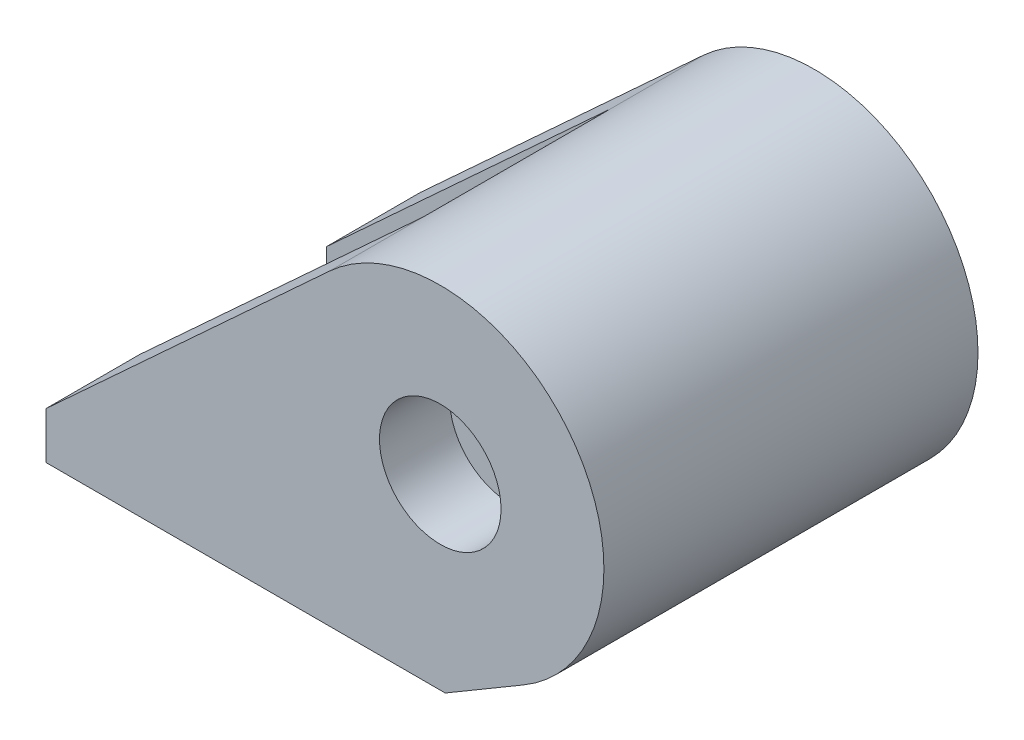
from build123d import *
from build123d.topology import SkipClean

# Parameters (mm, degrees)
EXTRUDE_1_DEPTH          = 80
SKETCH_2_R               = 13
CUT_EXTRUDE_2_DEPTH      = 15
CUT_EXTRUDE_START        = -15
SKETCH_4_R               = 13
CUT_EXTRUDE_3_DEPTH      = 15
CUT_EXTRUDE_4_DEPTH      = 123.918354375
CUT_EXTRUDE_4_DEPTH_BACK = 123.918354375
SKETCH_5_W               = 20
SKETCH_5_H               = 40
CUT_EXTRUDE_6_DEPTH      = 123.918354375
CUT_EXTRUDE_6_DEPTH_BACK = 24
CUT_EXTRUDE_7_DEPTH      = 131.345394404
CUT_EXTRUDE_8_DEPTH      = 32
CUT_EXTRUDE_8_DEPTH_BACK = 24
SKETCH_10_W              = 30
SKETCH_10_H              = 40
CUT_EXTRUDE_9_DEPTH      = 6
SKETCH_13_W              = 10.619852086
SKETCH_13_H              = 40
CUT_EXTRUDE_10_DEPTH     = 71
EXTRUDE_3_DEPTH          = 60


with BuildPart() as part:
    # Эскиз1 → Бобышка-Вытянуть1 (new body)
    with BuildSketch(Plane.XY):
        with BuildLine():
            Line((-84.314422505, -30), (-23.694570419, 25.759800711))
            ThreePointArc((-23.694570419, 25.759800711), (28.113366731, 20.847988178), (17.769230769, -30.153846154))
            Line((17.769230769, -30.153846154), (1.060606061, -40))
            Line((1.060606061, -40), (-84.314422505, -40))
            Line((-84.314422505, -40), (-84.314422505, -30))
        make_face()
    extrude(amount=EXTRUDE_1_DEPTH)

    # Эскиз2 → Вырез-Вытянуть2 (cut)
    with BuildSketch(Plane.XY):
        Circle(SKETCH_2_R)
    extrude(amount=CUT_EXTRUDE_2_DEPTH, mode=Mode.SUBTRACT)

    # Эскиз4 → Вырез-Вытянуть3 (cut)
    with BuildSketch(Plane.XY.offset(80).offset(CUT_EXTRUDE_START)):
        Circle(SKETCH_4_R)
    extrude(amount=CUT_EXTRUDE_3_DEPTH, mode=Mode.SUBTRACT)

    # Эскиз5 → Вырез-Вытянуть4 (cut, two sides: drawn at the far end of the back side and taken through both)
    with BuildSketch(Plane(origin=(0, 0, 0), x_dir=(1, 0, 0), z_dir=(0, 1, 0)).offset(-CUT_EXTRUDE_4_DEPTH_BACK)):
        with Locations((-74.314422505, -40)):
            Rectangle(SKETCH_5_W, SKETCH_5_H)
    extrude(amount=CUT_EXTRUDE_4_DEPTH + CUT_EXTRUDE_4_DEPTH_BACK, mode=Mode.SUBTRACT)

    # Эскиз6 → Вырез-Вытянуть6 (cut, two sides: drawn at the far end of the back side and taken through both)
    with BuildSketch(Plane(origin=(0, 0, 0), x_dir=(1, 0, 0), z_dir=(0, 1, 0)).offset(-CUT_EXTRUDE_6_DEPTH_BACK)):
        with BuildLine():
            Line((-55, -25), (-84.314422505, -25))
            Line((-84.314422505, -25), (-84.314422505, -55))
            Line((-84.314422505, -55), (-55, -55))
            ThreePointArc((-55, -55), (-40, -40), (-55, -25))
        make_face()
    extrude(amount=CUT_EXTRUDE_6_DEPTH + CUT_EXTRUDE_6_DEPTH_BACK, mode=Mode.SUBTRACT)

    # Эскиз9 → Вырез-Вытянуть7 (cut, through all)
    with BuildSketch(Plane(origin=(0, -24, 0), x_dir=(1, 0, 0), z_dir=(0, 1, 0))):
        with BuildLine():
            Line((-55, -48), (-92.733432528, -48))
            Line((-92.733432528, -48), (-92.733432528, -32))
            Line((-92.733432528, -32), (-55, -32))
            ThreePointArc((-55, -32), (-47, -40), (-55, -48))
        make_face()
    extrude(amount=-CUT_EXTRUDE_7_DEPTH, mode=Mode.SUBTRACT)

    # Эскиз10 → Вырез-Вытянуть8 (cut, two sides: drawn at the far end of the back side and taken through both)
    with BuildSketch(Plane(origin=(0, 0, 0), x_dir=(1, 0, 0), z_dir=(0, 1, 0)).offset(-CUT_EXTRUDE_8_DEPTH_BACK)):
        with Locations((-49.314422505, -40)):
            Rectangle(SKETCH_10_W, SKETCH_10_H)
    extrude(amount=CUT_EXTRUDE_8_DEPTH + CUT_EXTRUDE_8_DEPTH_BACK, mode=Mode.SUBTRACT)

    # Эскиз11 → Вырез-Вытянуть9 (cut)
    with BuildSketch(Plane(origin=(0, -24, 0), x_dir=(1, 0, 0), z_dir=(0, 1, 0))):
        with BuildLine():
            Line((-55, -25), (-81.861005174, -25))
            Line((-81.861005174, -25), (-81.861005174, -55))
            Line((-81.861005174, -55), (-55, -55))
            ThreePointArc((-55, -55), (-40, -40), (-55, -25))
        make_face()
    extrude(amount=-CUT_EXTRUDE_9_DEPTH, mode=Mode.SUBTRACT)

    # Эскиз13 → Вырез-Вытянуть10 (cut)
    with BuildSketch(Plane(origin=(0, -24, 0), x_dir=(1, 0, 0), z_dir=(0, 1, 0))):
        with Locations((-29.004496462, -40)):
            Rectangle(SKETCH_13_W, SKETCH_13_H)
    extrude(amount=CUT_EXTRUDE_10_DEPTH, mode=Mode.SUBTRACT)

    # Эскиз12 → Бобышка-Вытянуть3 (add)
    with SkipClean():  # the faces are left unmerged after this step: merging them gives an invalid solid
        with BuildSketch(Plane.XY):
            with BuildLine():
                Line((-35, 0), (-35, -24))
                Line((-35, -24), (-25.475478406, -24))
                ThreePointArc((-25.475478406, -24), (32.53184397, 12.9104271), (-35, 0))
            make_face()
        extrude(amount=EXTRUDE_3_DEPTH)


solid = part.part
